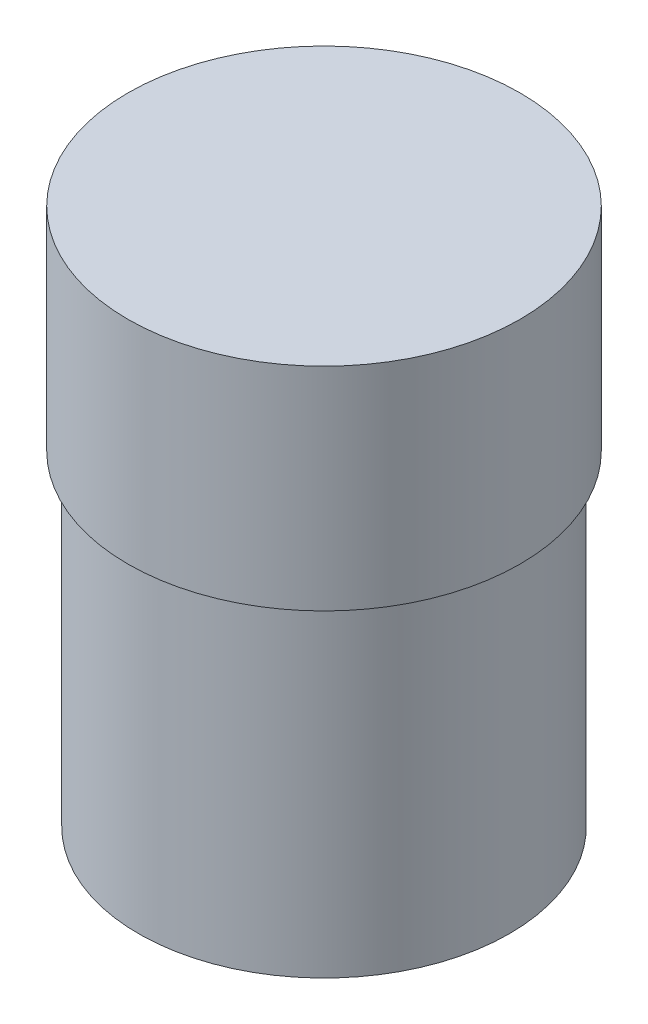
from build123d import *


with BuildPart() as part:
    # Sketch1 → Revolve1 (revolve)
    with BuildSketch(Plane.XY, mode=Mode.PRIVATE) as revolve1_sk:
        Polygon((0, 50.7), (-18.5, 50.7), (-18.5, 30.7), (-17.5, 30.7), (-17.5, 0), (0, 0), align=None)
    revolve(revolve1_sk.sketch.rotate(Axis((0, 50.7, 0), (0, 1, 0)), 180), axis=Axis((0, 50.7, 0), (0, 1, 0)))


solid = part.part
